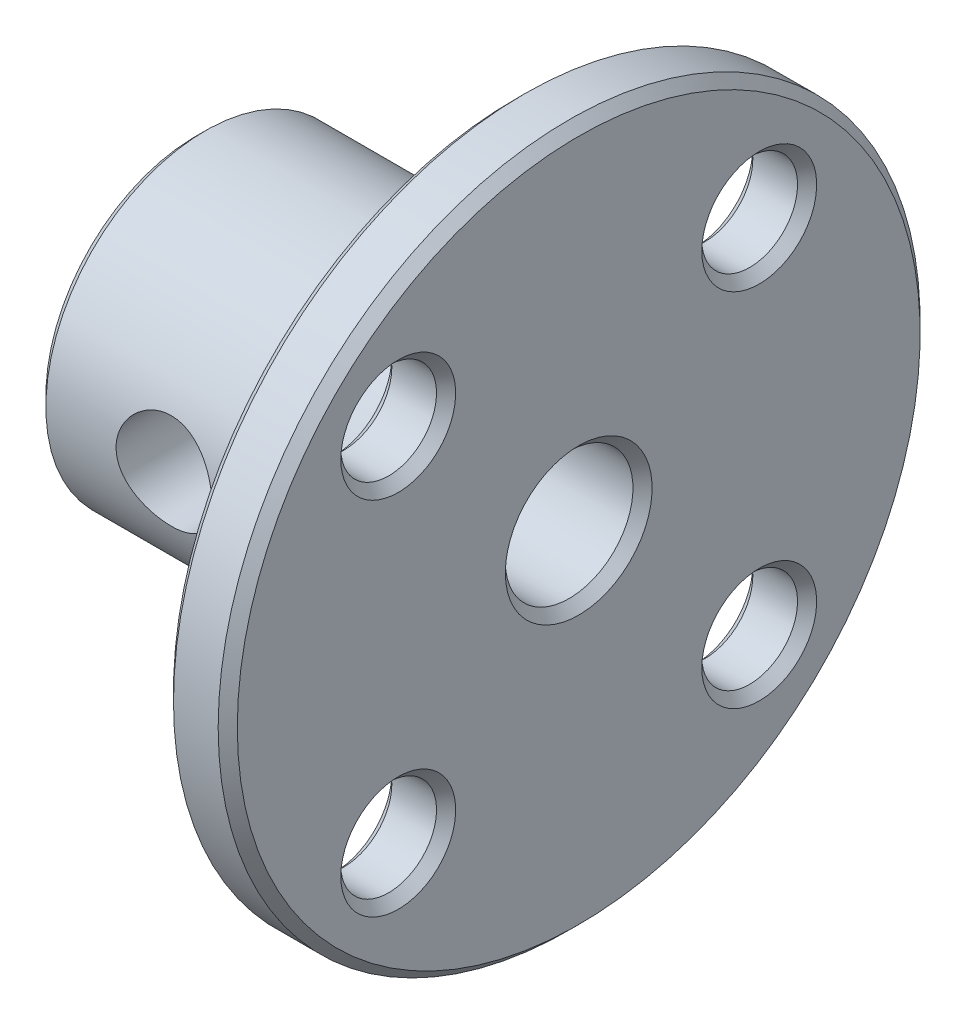
from build123d import *

# Parameters (mm, degrees)
SKETCH2_R          = 2
SKETCH2_R_2        = 1.5
CUT_EXTRUDE1_DEPTH = 12
CHAMFER1_SIZE      = 0.3
SKETCH3_R          = 1.5
CUT_EXTRUDE2_DEPTH = 6


with BuildPart() as part:
    # Sketch1 → Revolve1 (revolve)
    with BuildSketch(Plane.XY, mode=Mode.PRIVATE) as revolve1_sk:
        Polygon((-6, 0), (6, 0), (6, 11), (4, 11), (4, 5), (-6, 5), align=None)
    revolve(revolve1_sk.sketch.rotate(Axis((-6, 0, 0), (1, 0, 0)), 90), axis=Axis((-6, 0, 0), (1, 0, 0)))

    # Sketch2 → Cut-Extrude1 (cut)
    with BuildSketch(Plane.ZY.offset(6)):
        Circle(SKETCH2_R)
        with Locations((-5.656854249, 5.656854249)):
            Circle(SKETCH2_R_2)
        with Locations((5.656854249, 5.656854249)):
            Circle(SKETCH2_R_2)
        with Locations((5.656854249, -5.656854249)):
            Circle(SKETCH2_R_2)
        with Locations((-5.656854249, -5.656854249)):
            Circle(SKETCH2_R_2)
    extrude(amount=-CUT_EXTRUDE1_DEPTH, mode=Mode.SUBTRACT)

    # Chamfer1
    chamfer1_edges = [part.edges().sort_by_distance(p)[0] for p in [
        (6, -5.656854249, -7.156854249),
        (4, -5.656854249, -7.156854249),
        (6, -5.656854249, 4.156854249),
        (4, -5.656854249, 4.156854249),
        (6, 5.656854249, 4.156854249),
        (4, 5.656854249, 4.156854249),
        (6, 5.656854249, -7.156854249),
        (4, 5.656854249, -7.156854249),
        (6, 0, -2),
        (-6, 0, -2),
        (4, 0, -5),
        (4, 0, -11),
        (6, 0, -11),
        (-6, 0, -5),
    ]]
    chamfer(chamfer1_edges, length=CHAMFER1_SIZE)

    # Sketch3 → Cut-Extrude2 (cut, symmetric)
    with BuildSketch(Plane.XY):
        with Locations((-2, 0)):
            Circle(SKETCH3_R)
    extrude(amount=CUT_EXTRUDE2_DEPTH, both=True, mode=Mode.SUBTRACT)


solid = part.part
